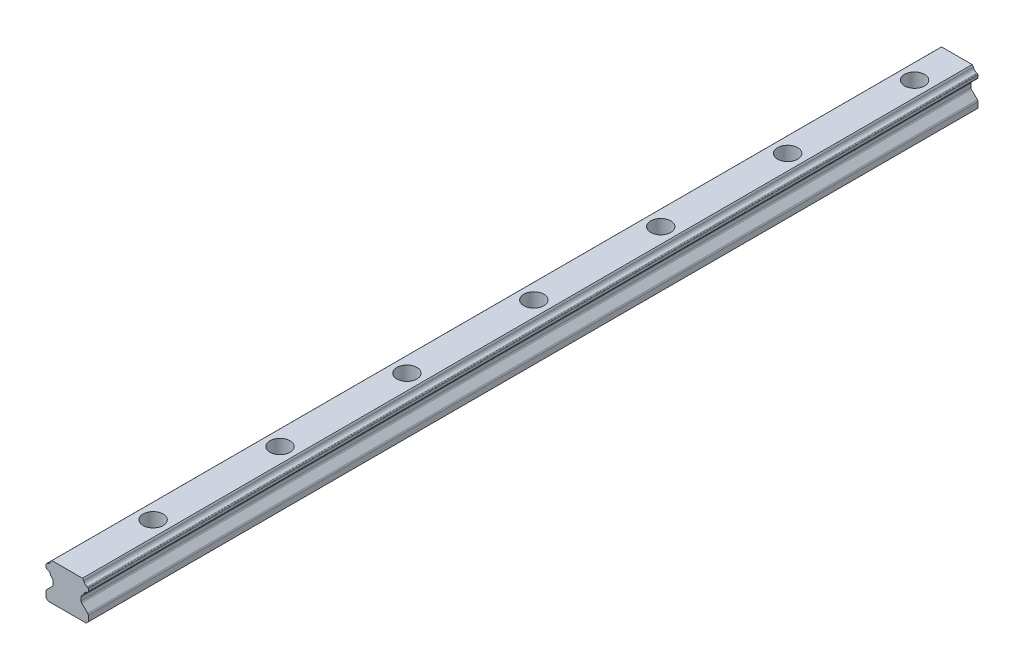
from build123d import *

# Parameters (mm, degrees)
BOSS_EXTRUDE1_DEPTH                     = 420.64
CBORE_FOR_M5_HEX_HEAD_BOLT1_D           = 6
CBORE_FOR_M5_HEX_HEAD_BOLT1_CBORE_D     = 9.5
CBORE_FOR_M5_HEX_HEAD_BOLT1_CBORE_DEPTH = 8.5


with BuildPart() as part:
    # Model → Boss-Extrude1 (new body)
    with BuildSketch(Plane.XY):
        with BuildLine():
            Line((-9, 0), (-10, 1))
            Line((-10, 1), (-10, 3.656507))
            ThreePointArc((-10, 3.656507), (-9.923879652, 4.039190515), (-9.707107, 4.363614))
            Line((-9.707107, 4.363614), (-6.892893, 7.177827))
            ThreePointArc((-6.892893, 7.177827), (-6.676120348, 7.502250485), (-6.6, 7.884934))
            Line((-6.6, 7.884934), (-6.6, 9.445065))
            ThreePointArc((-6.6, 9.445065), (-6.676120133, 9.827749063), (-6.892893, 10.152173))
            Line((-6.892893, 10.152173), (-7.630162, 10.889441))
            ThreePointArc((-7.630162, 10.889441), (-7.773916111, 11.035785789), (-7.846806076, 11.22753848))
            ThreePointArc((-7.846806076, 11.22753848), (-8.396387934, 12.262927951), (-9.431777507, 12.812509617))
            ThreePointArc((-9.431777507, 12.812509617), (-9.571493724, 12.861817566), (-9.690626, 12.949905))
            Line((-9.690626, 12.949905), (-9.853554, 13.112833))
            ThreePointArc((-9.853554, 13.112833), (-9.961939973, 13.275044564), (-10, 13.466386))
            Line((-10, 13.466386), (-10, 14.523614))
            ThreePointArc((-10, 14.523614), (-9.961940015, 14.714955453), (-9.853554, 14.877167))
            Line((-9.853554, 14.877167), (-9.678501, 15.052219))
            ThreePointArc((-9.678501, 15.052219), (-9.560417777, 15.139748282), (-9.421985167, 15.189159165))
            ThreePointArc((-9.421985167, 15.189159165), (-8.395921393, 15.736919214), (-7.848161791, 16.762983227))
            ThreePointArc((-7.848161791, 16.762983227), (-7.775191189, 16.953001466), (-7.632531, 17.09819))
            Line((-7.632531, 17.09819), (-7.230721, 17.5))
            Line((-7.230721, 17.5), (7.230721, 17.5))
            Line((7.230721, 17.5), (7.632531, 17.09819))
            ThreePointArc((7.632531, 17.09819), (7.775191683, 16.953001656), (7.848162914, 16.762983433))
            ThreePointArc((7.848162914, 16.762983433), (8.395922282, 15.736920132), (9.421985254, 15.189160148))
            ThreePointArc((9.421985254, 15.189160148), (9.560417914, 15.139748806), (9.678501, 15.052219))
            Line((9.678501, 15.052219), (9.853554, 14.877167))
            ThreePointArc((9.853554, 14.877167), (9.961939973, 14.714955436), (10, 14.523614))
            Line((10, 14.523614), (10, 13.466386))
            ThreePointArc((10, 13.466386), (9.961940015, 13.275044547), (9.853554, 13.112833))
            Line((9.853554, 13.112833), (9.690626, 12.949905))
            ThreePointArc((9.690626, 12.949905), (9.571494062, 12.861817368), (9.431778146, 12.812509028))
            ThreePointArc((9.431778146, 12.812509028), (8.39638873, 12.262927298), (7.846806979, 11.227537892))
            ThreePointArc((7.846806979, 11.227537892), (7.77391648, 11.035785414), (7.630162, 10.889441))
            Line((7.630162, 10.889441), (6.892893, 10.152173))
            ThreePointArc((6.892893, 10.152173), (6.676120157, 9.827749053), (6.6, 9.445065))
            Line((6.6, 9.445065), (6.6, 7.884934))
            ThreePointArc((6.6, 7.884934), (6.676120325, 7.502250475), (6.892893, 7.177827))
            Line((6.892893, 7.177827), (9.707107, 4.363614))
            ThreePointArc((9.707107, 4.363614), (9.923879675, 4.039190525), (10, 3.656507))
            Line((10, 3.656507), (10, 1))
            Line((10, 1), (9, 0))
            Line((9, 0), (-9, 0))
        make_face()
    extrude(amount=BOSS_EXTRUDE1_DEPTH)

    # CBORE for M5 Hex Head Bolt1 (through all)
    with Locations(Plane(origin=(0, 17.5, 0), x_dir=(1, 0, 0), z_dir=(0, 1, 0))):
        with Locations((0, -20), (0, -80), (0, -140), (0, -200), (0, -260), (0, -320), (0, -380), (0, -440), (0, -500), (0, -560), (0, -620), (0, -680), (0, -740), (0, -800), (0, -860), (0, -920), (0, -980)):
            CounterBoreHole(CBORE_FOR_M5_HEX_HEAD_BOLT1_D / 2, CBORE_FOR_M5_HEX_HEAD_BOLT1_CBORE_D / 2, CBORE_FOR_M5_HEX_HEAD_BOLT1_CBORE_DEPTH)


solid = part.part
